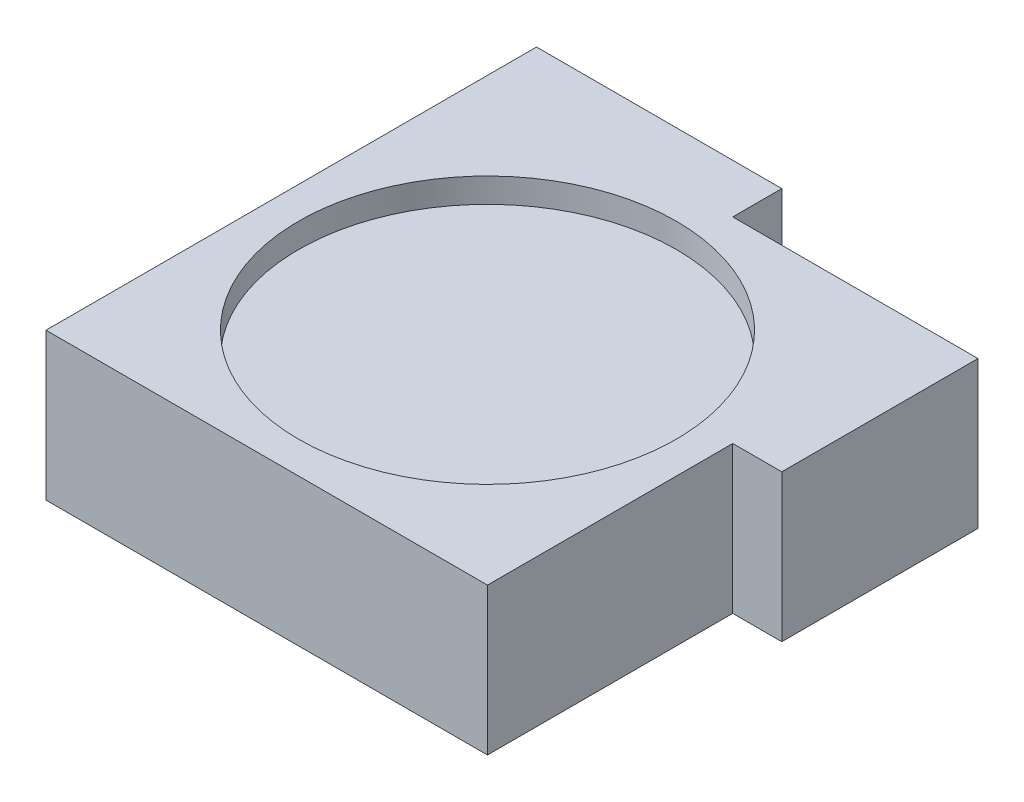
from build123d import *

# Parameters (mm, degrees)
BOSS_EXTRUDE2_DEPTH = 30
SKETCH2_R           = 38.5
CUT_EXTRUDE2_DEPTH  = 5


with BuildPart() as part:
    # Sketch1 → Boss-Extrude2 (new body)
    with BuildSketch(Plane(origin=(0, 0, 0), x_dir=(1, 0, 0), z_dir=(0, 1, 0))):
        Polygon((50, 100), (50, 90), (100, 90), (100, 50), (90, 50), (90, 0), (0, 0), (0, 100), align=None)
    extrude(amount=BOSS_EXTRUDE2_DEPTH)

    # Sketch2 → Cut-Extrude2 (cut)
    with BuildSketch(Plane(origin=(0, 30, 0), x_dir=(1, 0, 0), z_dir=(0, 1, 0))):
        with Locations(Location((45, 45, 0), (0, 0, 270))):
            Circle(SKETCH2_R)
    extrude(amount=-CUT_EXTRUDE2_DEPTH, mode=Mode.SUBTRACT)


solid = part.part
